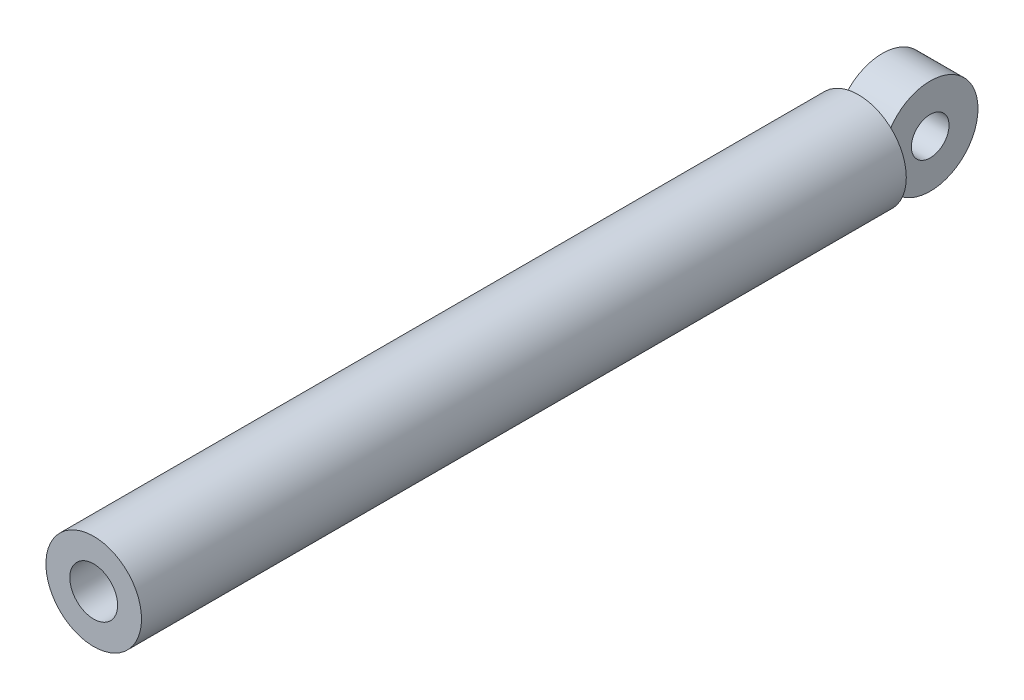
from build123d import *

# Parameters (mm, degrees)
SKETCH1_R           = 6.35
BOSS_EXTRUDE1_DEPTH = 101.6
SKETCH2_R           = 3.175
CUT_EXTRUDE1_DEPTH  = 88.9
SKETCH3_R           = 6.35
SKETCH3_R_2         = 2.5
BOSS_EXTRUDE2_DEPTH = 3.175


with BuildPart() as part:
    # Sketch1 → Boss-Extrude1 (new body)
    with BuildSketch(Plane.XY):
        Circle(SKETCH1_R)
    extrude(amount=BOSS_EXTRUDE1_DEPTH)

    # Sketch2 → Cut-Extrude1 (cut)
    with BuildSketch(Plane.XY.offset(101.6)):
        Circle(SKETCH2_R)
    extrude(amount=-CUT_EXTRUDE1_DEPTH, mode=Mode.SUBTRACT)


with BuildPart() as body_2:
    # Sketch3 → Boss-Extrude2 (new, symmetric)
    with BuildSketch(Plane(origin=(0, 0, 0), x_dir=(0, 0, -1), z_dir=(1, 0, 0))):
        with Locations((6.35, 0)):
            Circle(SKETCH3_R)
        with Locations((6.35, 0)):
            Circle(SKETCH3_R_2, mode=Mode.SUBTRACT)
    extrude(amount=BOSS_EXTRUDE2_DEPTH, both=True)


solid = Compound([part.part, body_2.part])
